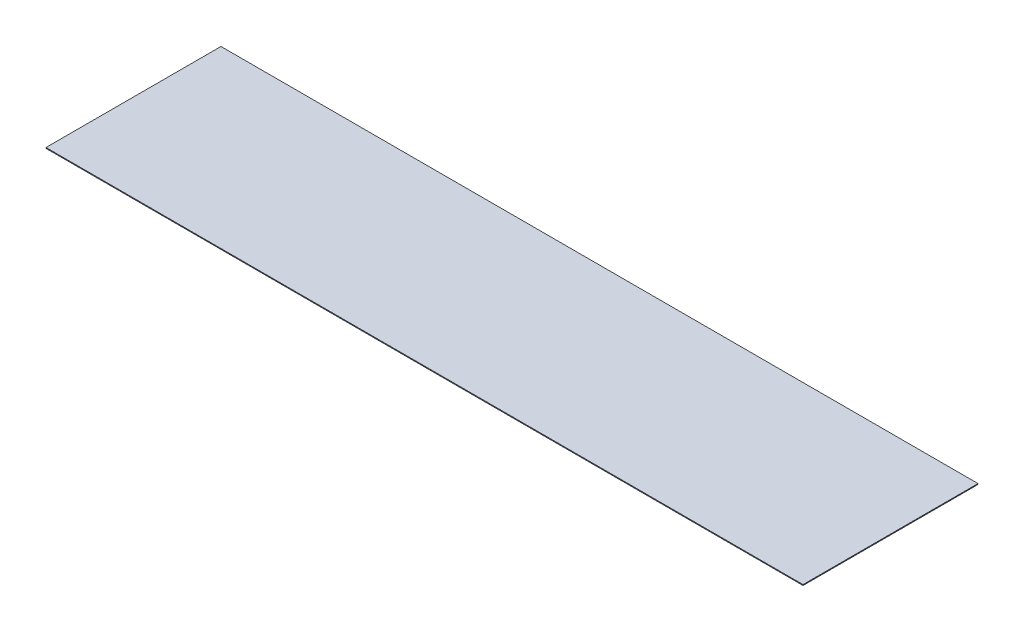
from build123d import *

# Parameters (mm, degrees)
CROQUIS1_W              = 1800
CROQUIS1_H              = 416
SALIENTE_EXTRUIR1_DEPTH = 2


with BuildPart() as part:
    # Croquis1 → Saliente-Extruir1 (new body)
    with BuildSketch(Plane(origin=(0, 0, 0), x_dir=(1, 0, 0), z_dir=(0, 1, 0))):
        Rectangle(CROQUIS1_W, CROQUIS1_H)
    extrude(amount=SALIENTE_EXTRUIR1_DEPTH)


solid = part.part
